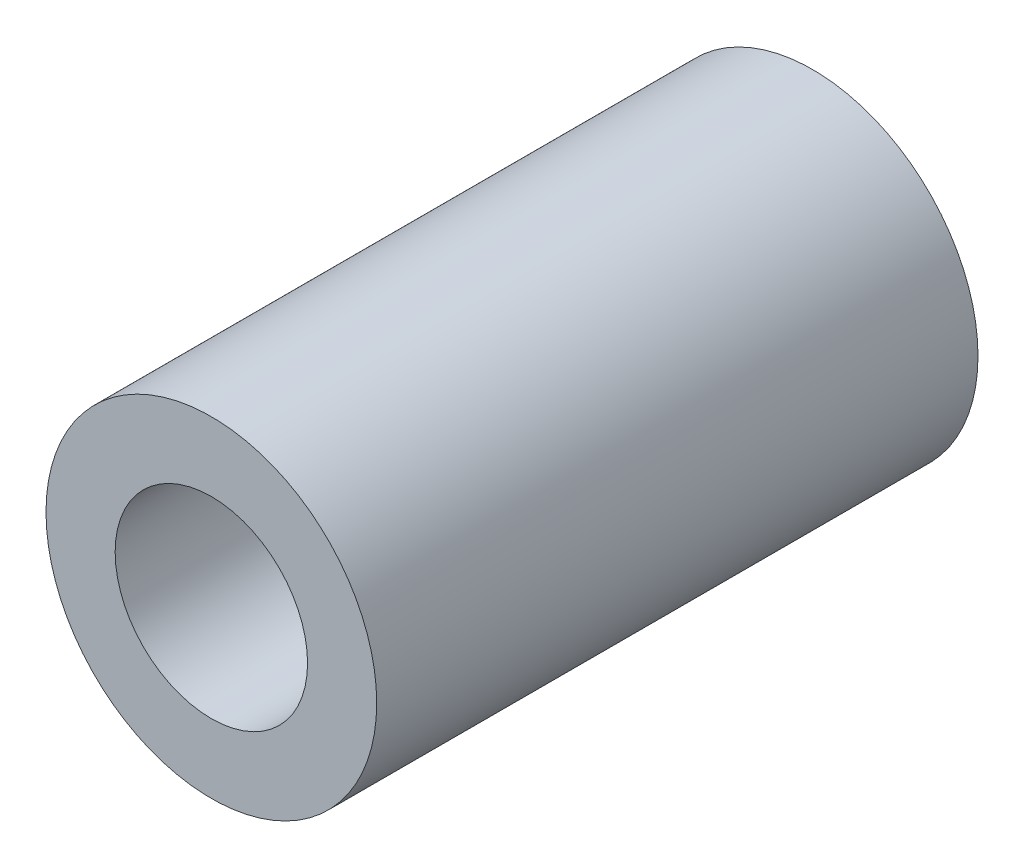
from build123d import *

# Parameters (mm, degrees)
SKETCH_1_R      = 2.75
SKETCH_1_R_2    = 1.6
EXTRUDE_1_DEPTH = 10


with BuildPart() as part:
    # 草圖1 → 填料-伸長1 (new body)
    with BuildSketch(Plane.XY):
        Circle(SKETCH_1_R)
        Circle(SKETCH_1_R_2, mode=Mode.SUBTRACT)
    extrude(amount=EXTRUDE_1_DEPTH)


solid = part.part
